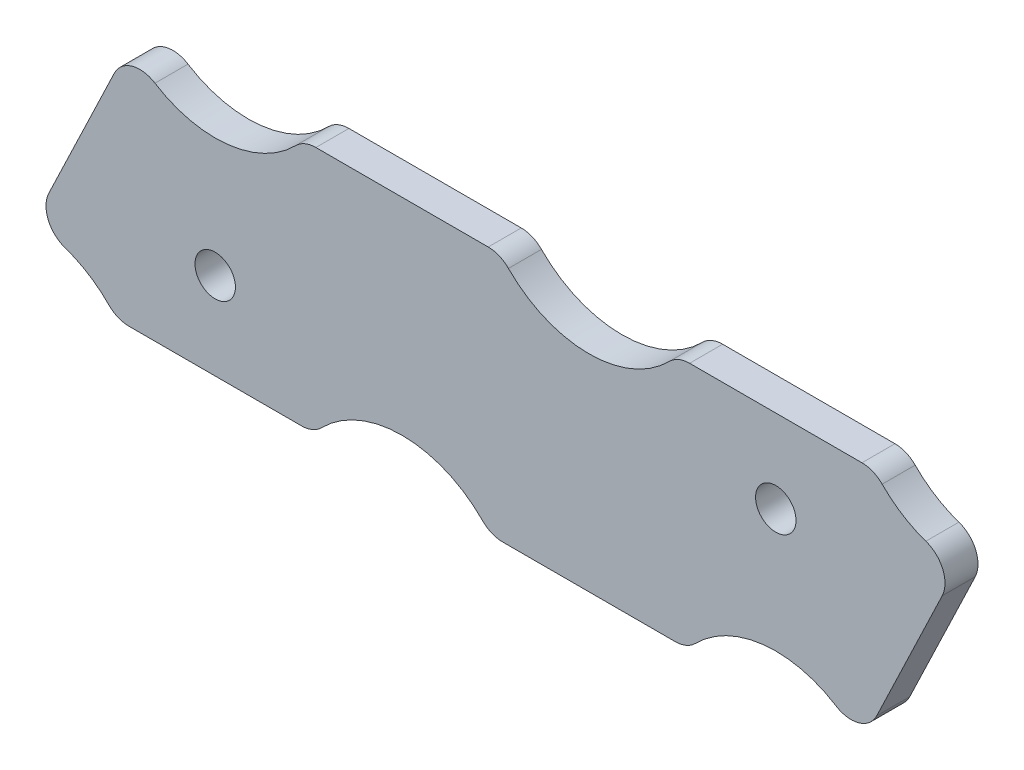
from build123d import *

# Parameters (mm, degrees)
BOSS_EXTRUDE1_DEPTH = 2.032
FILLET1_R           = 2
SKETCH4_R           = 1.2446
CUT_EXTRUDE1_DEPTH  = 75.115872934
CUT_EXTRUDE2_DEPTH  = 75.115872934


with BuildPart() as part:
    # Sketch3 → Boss-Extrude1 (new body)
    with BuildSketch(Plane.XY):
        with BuildLine():
            Line((62.980794963, 30.66873734), (50.569205037, 30.66873734))
            ThreePointArc((50.569205037, 30.66873734), (45.275, 28.075), (39.980794963, 30.66873734))
            Line((39.980794963, 30.66873734), (27.569205037, 30.66873734))
            ThreePointArc((27.569205037, 30.66873734), (22.275, 28.075), (16.980794963, 30.66873734))
            Line((16.980794963, 30.66873734), (10.658308864, 17.473983742))
            ThreePointArc((10.658308864, 17.473983742), (13.670205209, 16.817167392), (16.069205037, 14.88126266))
            Line((16.069205037, 14.88126266), (28.480794963, 14.88126266))
            ThreePointArc((28.480794963, 14.88126266), (33.775, 17.475), (39.069205037, 14.88126266))
            Line((39.069205037, 14.88126266), (51.480794963, 14.88126266))
            ThreePointArc((51.480794963, 14.88126266), (56.775, 17.475), (62.069205037, 14.88126266))
            Line((62.069205037, 14.88126266), (68.391691136, 28.076016258))
            ThreePointArc((68.391691136, 28.076016258), (65.379794791, 28.732832608), (62.980794963, 30.66873734))
        make_face()
    extrude(amount=BOSS_EXTRUDE1_DEPTH)

    # Fillet1
    fillet1_edges = [part.edges().sort_by_distance(p)[0] for p in [
        (68.391691136, 28.076016258, 1.016),
        (62.069205037, 14.88126266, 1.016),
        (51.480794963, 14.88126266, 1.016),
        (39.069205037, 14.88126266, 1.016),
        (28.480794963, 14.88126266, 1.016),
        (16.069205037, 14.88126266, 1.016),
        (10.658308864, 17.473983742, 1.016),
        (16.980794963, 30.66873734, 1.016),
        (27.569205037, 30.66873734, 1.016),
        (39.980794963, 30.66873734, 1.016),
        (50.569205037, 30.66873734, 1.016),
        (62.980794963, 30.66873734, 1.016),
    ]]
    fillet(fillet1_edges, radius=FILLET1_R)

    # Sketch4 → Cut-Extrude1 (cut, through all)
    with BuildSketch(Plane.XY.offset(2.032)):
        with Locations((22.275, 20.49206771)):
            Circle(SKETCH4_R)
        with Locations((56.775, 25.307013878)):
            Circle(SKETCH4_R)
    extrude(amount=-CUT_EXTRUDE1_DEPTH, mode=Mode.SUBTRACT)

    # Sketch6 → Cut-Extrude2 (cut, through all)
    with BuildSketch(Plane.XY.offset(2.032)):
        with BuildLine():
            Line((62.077939702, 30.66873734), (51.472060298, 30.66873734))
            ThreePointArc((51.472060298, 30.66873734), (50.699880618, 30.513659708), (50.047448735, 30.072475883))
            ThreePointArc((50.047448735, 30.072475883), (45.275, 28.075), (40.502551265, 30.072475883))
            ThreePointArc((40.502551265, 30.072475883), (39.850119382, 30.513659708), (39.077939702, 30.66873734))
            Line((39.077939702, 30.66873734), (28.472060298, 30.66873734))
            ThreePointArc((28.472060298, 30.66873734), (27.699880618, 30.513659708), (27.047448735, 30.072475883))
            ThreePointArc((27.047448735, 30.072475883), (23.046259875, 28.119539219), (18.704481797, 29.105661435))
            ThreePointArc((18.704481797, 29.105661435), (17.084104729, 29.334902549), (15.835023411, 28.277561926))
            Line((15.835023411, 28.277561926), (11.804080417, 19.865159157))
            ThreePointArc((11.804080417, 19.865159157), (11.762608918, 18.229172162), (12.956514205, 17.109902981))
            ThreePointArc((12.956514205, 17.109902981), (14.346493431, 16.443724254), (15.547448735, 15.477524117))
            ThreePointArc((15.547448735, 15.477524117), (16.199880618, 15.036340292), (16.972060298, 14.88126266))
            Line((16.972060298, 14.88126266), (27.577939702, 14.88126266))
            ThreePointArc((27.577939702, 14.88126266), (28.350119382, 15.036340292), (29.002551265, 15.477524117))
            ThreePointArc((29.002551265, 15.477524117), (33.775, 17.475), (38.547448735, 15.477524117))
            ThreePointArc((38.547448735, 15.477524117), (39.199880618, 15.036340292), (39.972060298, 14.88126266))
            Line((39.972060298, 14.88126266), (50.577939702, 14.88126266))
            ThreePointArc((50.577939702, 14.88126266), (51.350119382, 15.036340292), (52.002551265, 15.477524117))
            ThreePointArc((52.002551265, 15.477524117), (56.003740125, 17.430460781), (60.345518203, 16.444338565))
            ThreePointArc((60.345518203, 16.444338565), (61.965895271, 16.215097451), (63.214976589, 17.272438074))
            Line((63.214976589, 17.272438074), (67.245919583, 25.684840843))
            ThreePointArc((67.245919583, 25.684840843), (67.287391082, 27.320827838), (66.093485795, 28.440097019))
            ThreePointArc((66.093485795, 28.440097019), (64.703506569, 29.106275746), (63.502551265, 30.072475883))
            ThreePointArc((63.502551265, 30.072475883), (62.850119382, 30.513659708), (62.077939702, 30.66873734))
        make_face()
        with BuildLine():
            Line((16.064084682, 28.1678034), (12.033141688, 19.755400631))
            ThreePointArc((12.033141688, 19.755400631), (11.99693707, 18.327183984), (13.039216385, 17.350061989))
            ThreePointArc((13.039216385, 17.350061989), (14.481890346, 16.658628129), (15.728374403, 15.655798912))
            ThreePointArc((15.728374403, 15.655798912), (16.297947437, 15.270645433), (16.972060298, 15.13526266))
            Line((16.972060298, 15.13526266), (27.577939702, 15.13526266))
            ThreePointArc((27.577939702, 15.13526266), (28.252052563, 15.270645433), (28.821625597, 15.655798912))
            ThreePointArc((28.821625597, 15.655798912), (33.775, 17.729), (38.728374403, 15.655798912))
            ThreePointArc((38.728374403, 15.655798912), (39.297947437, 15.270645433), (39.972060298, 15.13526266))
            Line((39.972060298, 15.13526266), (50.577939702, 15.13526266))
            ThreePointArc((50.577939702, 15.13526266), (51.252052563, 15.270645433), (51.821625597, 15.655798912))
            ThreePointArc((51.821625597, 15.655798912), (55.974501318, 17.682772279), (60.480878147, 16.659265728))
            ThreePointArc((60.480878147, 16.659265728), (61.895467327, 16.459138236), (62.985915318, 17.3821966))
            Line((62.985915318, 17.3821966), (67.016858312, 25.794599369))
            ThreePointArc((67.016858312, 25.794599369), (67.05306293, 27.222816016), (66.010783615, 28.199938011))
            ThreePointArc((66.010783615, 28.199938011), (64.568109654, 28.891371871), (63.321625597, 29.894201088))
            ThreePointArc((63.321625597, 29.894201088), (62.752052563, 30.279354567), (62.077939702, 30.41473734))
            Line((62.077939702, 30.41473734), (51.472060298, 30.41473734))
            ThreePointArc((51.472060298, 30.41473734), (50.797947437, 30.279354567), (50.228374403, 29.894201088))
            ThreePointArc((50.228374403, 29.894201088), (45.275, 27.821), (40.321625597, 29.894201088))
            ThreePointArc((40.321625597, 29.894201088), (39.752052563, 30.279354567), (39.077939702, 30.41473734))
            Line((39.077939702, 30.41473734), (28.472060298, 30.41473734))
            ThreePointArc((28.472060298, 30.41473734), (27.797947437, 30.279354567), (27.228374403, 29.894201088))
            ThreePointArc((27.228374403, 29.894201088), (23.075498682, 27.867227721), (18.569121853, 28.890734272))
            ThreePointArc((18.569121853, 28.890734272), (17.154532673, 29.090861764), (16.064084682, 28.1678034))
        make_face(mode=Mode.SUBTRACT)
    extrude(amount=-CUT_EXTRUDE2_DEPTH, mode=Mode.SUBTRACT)


solid = part.part
